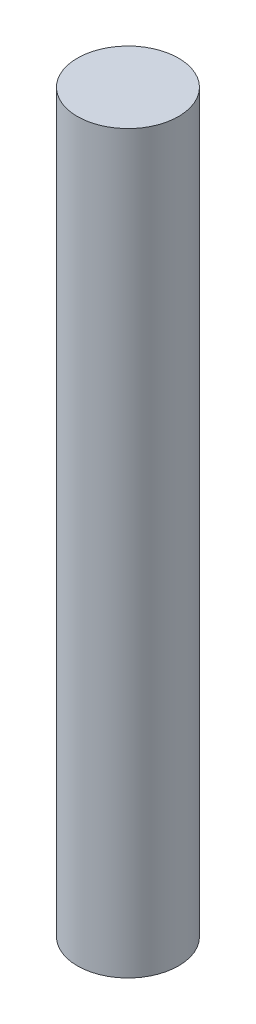
from build123d import *

# Parameters (mm, degrees)
SKETCH_1_R      = 6
EXTRUDE_1_DEPTH = 43.63


with BuildPart() as part:
    # 草图1 → 凸台-拉伸1 (new, symmetric)
    with BuildSketch(Plane(origin=(0, 0, 0), x_dir=(1, 0, 0), z_dir=(0, 1, 0))):
        with Locations(Location((0, 0, 0), (0, 0, 270))):
            Circle(SKETCH_1_R)
    extrude(amount=EXTRUDE_1_DEPTH, both=True)


solid = part.part
